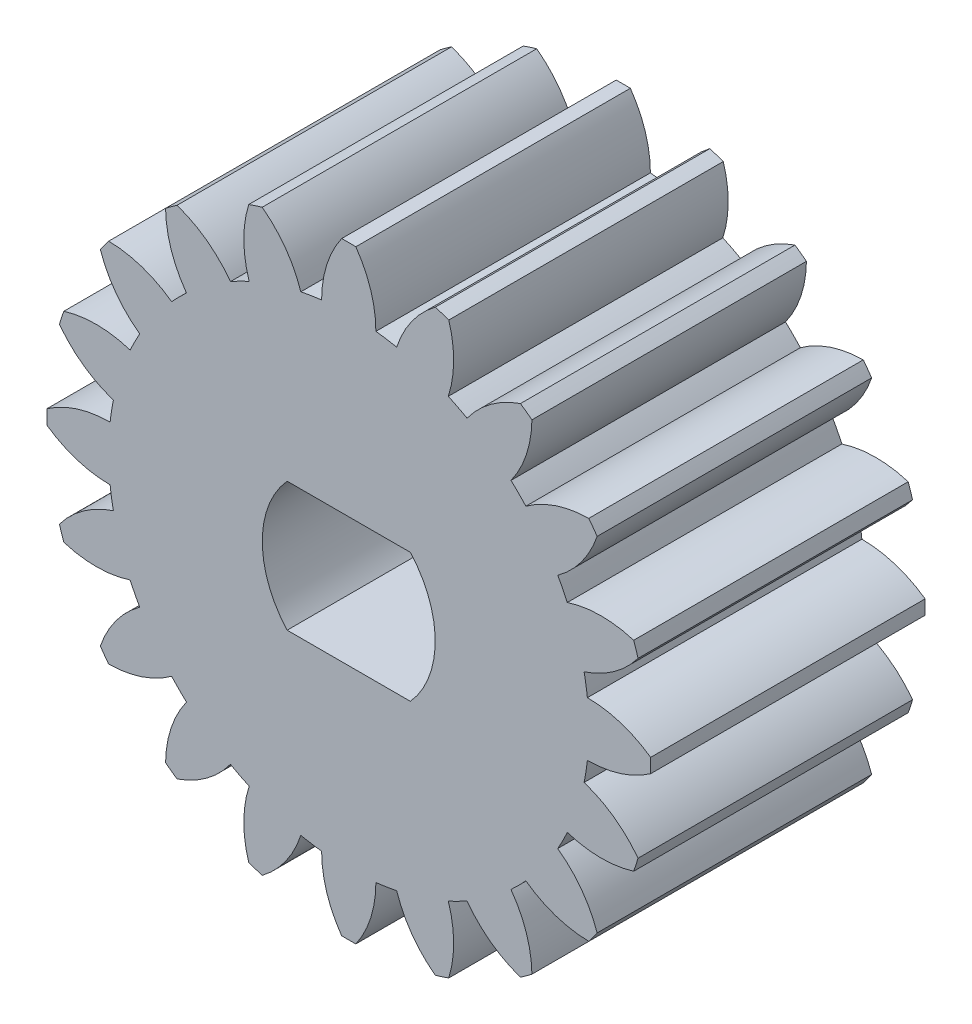
from build123d import *

# Parameters (mm, degrees)
BOSS_EXTRUDE1_DEPTH = 10


with BuildPart() as part:
    # Sketch1 → Boss-Extrude1 (new body)
    with BuildSketch(Plane.XY):
        with BuildLine():
            ThreePointArc((10.996962206, -0.2585), (11, 0), (10.996962206, 0.2585))
            ThreePointArc((10.996962206, 0.2585), (9.901430175, 0.801787583), (8.692954638, 0.988706562))
            ThreePointArc((8.692954638, 0.988706562), (8.641285292, 1.368645135), (8.573018284, 1.745954896))
            ThreePointArc((8.573018284, 1.745954896), (9.664585678, 2.297164887), (10.538613458, 3.152400099))
            ThreePointArc((10.538613458, 3.152400099), (10.461621679, 3.399186938), (10.378851672, 3.644096317))
            ThreePointArc((10.378851672, 3.644096317), (9.169053699, 3.822255499), (7.961964024, 3.626586533))
            ThreePointArc((7.961964024, 3.626586533), (7.79541608, 3.971962882), (7.613895169, 4.309710124))
            ThreePointArc((7.613895169, 4.309710124), (8.481704197, 5.171254853), (9.048671798, 6.254721311))
            ThreePointArc((9.048671798, 6.254721311), (8.899186938, 6.465637775), (8.744786823, 6.672983097))
            ThreePointArc((8.744786823, 6.672983097), (7.539146363, 6.468574414), (6.451600897, 5.909470946))
            ThreePointArc((6.451600897, 5.909470946), (6.186477229, 6.186477229), (5.909470946, 6.451600897))
            ThreePointArc((5.909470946, 6.451600897), (6.468574414, 7.539146363), (6.672983097, 8.744786823))
            ThreePointArc((6.672983097, 8.744786823), (6.465637775, 8.899186938), (6.254721311, 9.048671798))
            ThreePointArc((6.254721311, 9.048671798), (5.171254853, 8.481704197), (4.309710124, 7.613895169))
            ThreePointArc((4.309710124, 7.613895169), (3.971962882, 7.79541608), (3.626586533, 7.961964024))
            ThreePointArc((3.626586533, 7.961964024), (3.822255499, 9.169053699), (3.644096317, 10.378851672))
            ThreePointArc((3.644096317, 10.378851672), (3.399186938, 10.461621679), (3.152400099, 10.538613458))
            ThreePointArc((3.152400099, 10.538613458), (2.297164887, 9.664585678), (1.745954896, 8.573018284))
            ThreePointArc((1.745954896, 8.573018284), (1.368645135, 8.641285292), (0.988706562, 8.692954638))
            ThreePointArc((0.988706562, 8.692954638), (0.801787583, 9.901430175), (0.2585, 10.996962206))
            ThreePointArc((0.2585, 10.996962206), (0, 11), (-0.2585, 10.996962206))
            ThreePointArc((-0.2585, 10.996962206), (-0.801787583, 9.901430175), (-0.988706562, 8.692954638))
            ThreePointArc((-0.988706562, 8.692954638), (-1.368645135, 8.641285292), (-1.745954896, 8.573018284))
            ThreePointArc((-1.745954896, 8.573018284), (-2.297164887, 9.664585678), (-3.152400099, 10.538613458))
            ThreePointArc((-3.152400099, 10.538613458), (-3.399186938, 10.461621679), (-3.644096317, 10.378851672))
            ThreePointArc((-3.644096317, 10.378851672), (-3.822255499, 9.169053699), (-3.626586533, 7.961964024))
            ThreePointArc((-3.626586533, 7.961964024), (-3.971962882, 7.79541608), (-4.309710124, 7.613895169))
            ThreePointArc((-4.309710124, 7.613895169), (-5.171254853, 8.481704197), (-6.254721311, 9.048671798))
            ThreePointArc((-6.254721311, 9.048671798), (-6.465637775, 8.899186938), (-6.672983097, 8.744786823))
            ThreePointArc((-6.672983097, 8.744786823), (-6.468574414, 7.539146363), (-5.909470946, 6.451600897))
            ThreePointArc((-5.909470946, 6.451600897), (-6.186477229, 6.186477229), (-6.451600897, 5.909470946))
            ThreePointArc((-6.451600897, 5.909470946), (-7.539146363, 6.468574414), (-8.744786823, 6.672983097))
            ThreePointArc((-8.744786823, 6.672983097), (-8.899186938, 6.465637775), (-9.048671798, 6.254721311))
            ThreePointArc((-9.048671798, 6.254721311), (-8.481704197, 5.171254853), (-7.613895169, 4.309710124))
            ThreePointArc((-7.613895169, 4.309710124), (-7.79541608, 3.971962882), (-7.961964024, 3.626586533))
            ThreePointArc((-7.961964024, 3.626586533), (-9.169053699, 3.822255499), (-10.378851672, 3.644096317))
            ThreePointArc((-10.378851672, 3.644096317), (-10.461621679, 3.399186938), (-10.538613458, 3.152400099))
            ThreePointArc((-10.538613458, 3.152400099), (-9.664585678, 2.297164887), (-8.573018284, 1.745954896))
            ThreePointArc((-8.573018284, 1.745954896), (-8.641285292, 1.368645135), (-8.692954638, 0.988706562))
            ThreePointArc((-8.692954638, 0.988706562), (-9.901430175, 0.801787583), (-10.996962206, 0.2585))
            ThreePointArc((-10.996962206, 0.2585), (-11, 0), (-10.996962206, -0.2585))
            ThreePointArc((-10.996962206, -0.2585), (-9.901430175, -0.801787583), (-8.692954638, -0.988706562))
            ThreePointArc((-8.692954638, -0.988706562), (-8.641285292, -1.368645135), (-8.573018284, -1.745954896))
            ThreePointArc((-8.573018284, -1.745954896), (-9.664585678, -2.297164887), (-10.538613458, -3.152400099))
            ThreePointArc((-10.538613458, -3.152400099), (-10.461621679, -3.399186938), (-10.378851672, -3.644096317))
            ThreePointArc((-10.378851672, -3.644096317), (-9.169053699, -3.822255499), (-7.961964024, -3.626586533))
            ThreePointArc((-7.961964024, -3.626586533), (-7.79541608, -3.971962882), (-7.613895169, -4.309710124))
            ThreePointArc((-7.613895169, -4.309710124), (-8.481704197, -5.171254853), (-9.048671798, -6.254721311))
            ThreePointArc((-9.048671798, -6.254721311), (-8.899186938, -6.465637775), (-8.744786823, -6.672983097))
            ThreePointArc((-8.744786823, -6.672983097), (-7.539146363, -6.468574414), (-6.451600897, -5.909470946))
            ThreePointArc((-6.451600897, -5.909470946), (-6.186477229, -6.186477229), (-5.909470946, -6.451600897))
            ThreePointArc((-5.909470946, -6.451600897), (-6.468574414, -7.539146363), (-6.672983097, -8.744786823))
            ThreePointArc((-6.672983097, -8.744786823), (-6.465637775, -8.899186938), (-6.254721311, -9.048671798))
            ThreePointArc((-6.254721311, -9.048671798), (-5.171254853, -8.481704197), (-4.309710124, -7.613895169))
            ThreePointArc((-4.309710124, -7.613895169), (-3.971962882, -7.79541608), (-3.626586533, -7.961964024))
            ThreePointArc((-3.626586533, -7.961964024), (-3.822255499, -9.169053699), (-3.644096317, -10.378851672))
            ThreePointArc((-3.644096317, -10.378851672), (-3.399186938, -10.461621679), (-3.152400099, -10.538613458))
            ThreePointArc((-3.152400099, -10.538613458), (-2.297164887, -9.664585678), (-1.745954896, -8.573018284))
            ThreePointArc((-1.745954896, -8.573018284), (-1.368645135, -8.641285292), (-0.988706562, -8.692954638))
            ThreePointArc((-0.988706562, -8.692954638), (-0.801787583, -9.901430175), (-0.2585, -10.996962206))
            ThreePointArc((-0.2585, -10.996962206), (0, -11), (0.2585, -10.996962206))
            ThreePointArc((0.2585, -10.996962206), (0.801787583, -9.901430175), (0.988706562, -8.692954638))
            ThreePointArc((0.988706562, -8.692954638), (1.368645135, -8.641285292), (1.745954896, -8.573018284))
            ThreePointArc((1.745954896, -8.573018284), (2.297164887, -9.664585678), (3.152400099, -10.538613458))
            ThreePointArc((3.152400099, -10.538613458), (3.399186938, -10.461621679), (3.644096317, -10.378851672))
            ThreePointArc((3.644096317, -10.378851672), (3.822255499, -9.169053699), (3.626586533, -7.961964024))
            ThreePointArc((3.626586533, -7.961964024), (3.971962882, -7.79541608), (4.309710124, -7.613895169))
            ThreePointArc((4.309710124, -7.613895169), (5.171254853, -8.481704197), (6.254721311, -9.048671798))
            ThreePointArc((6.254721311, -9.048671798), (6.465637775, -8.899186938), (6.672983097, -8.744786823))
            ThreePointArc((6.672983097, -8.744786823), (6.468574414, -7.539146363), (5.909470946, -6.451600897))
            ThreePointArc((5.909470946, -6.451600897), (6.186477229, -6.186477229), (6.451600897, -5.909470946))
            ThreePointArc((6.451600897, -5.909470946), (7.539146363, -6.468574414), (8.744786823, -6.672983097))
            ThreePointArc((8.744786823, -6.672983097), (8.899186938, -6.465637775), (9.048671798, -6.254721311))
            ThreePointArc((9.048671798, -6.254721311), (8.481704197, -5.171254853), (7.613895169, -4.309710124))
            ThreePointArc((7.613895169, -4.309710124), (7.79541608, -3.971962882), (7.961964024, -3.626586533))
            ThreePointArc((7.961964024, -3.626586533), (9.169053699, -3.822255499), (10.378851672, -3.644096317))
            ThreePointArc((10.378851672, -3.644096317), (10.461621679, -3.399186938), (10.538613458, -3.152400099))
            ThreePointArc((10.538613458, -3.152400099), (9.664585678, -2.297164887), (8.573018284, -1.745954896))
            ThreePointArc((8.573018284, -1.745954896), (8.641285292, -1.368645135), (8.692954638, -0.988706562))
            ThreePointArc((8.692954638, -0.988706562), (9.901430175, -0.801787583), (10.996962206, -0.2585))
        make_face()
        with BuildLine():
            Line((-2.24374247, 2.35), (2.24374247, 2.35))
            ThreePointArc((2.24374247, 2.35), (3.15, 0), (2.24374247, -2.35))
            Line((2.24374247, -2.35), (-2.24374247, -2.35))
            ThreePointArc((-2.24374247, -2.35), (-3.15, 0), (-2.24374247, 2.35))
        make_face(mode=Mode.SUBTRACT)
    extrude(amount=BOSS_EXTRUDE1_DEPTH)


solid = part.part
